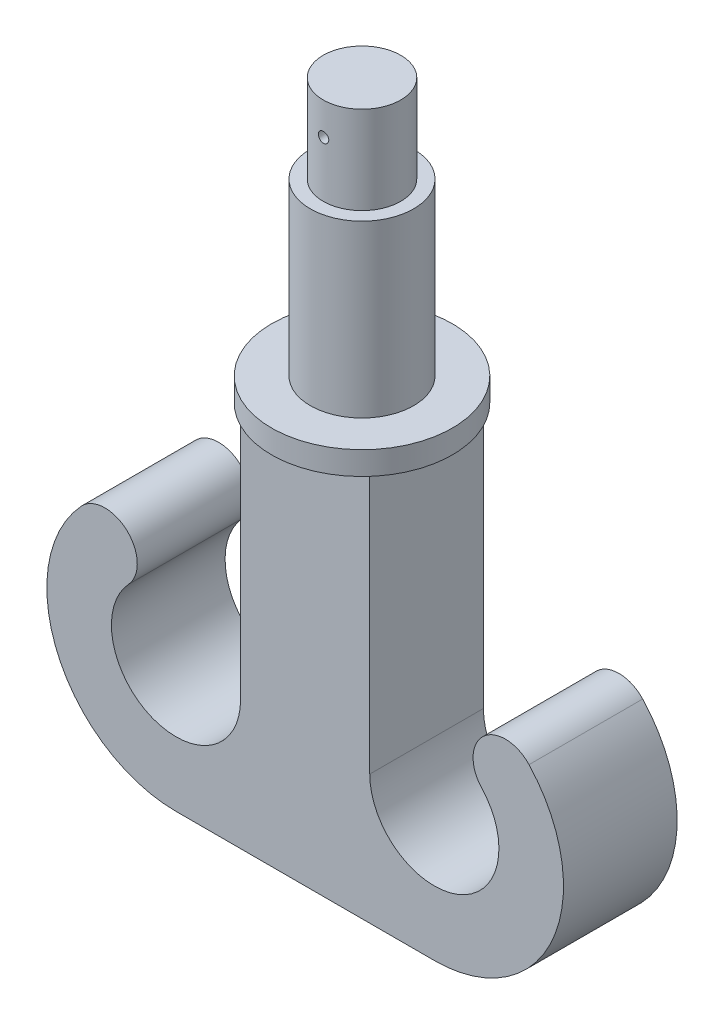
from build123d import *

# Parameters (mm, degrees)
BOSS_EXTRUDE1_DEPTH     = 22
CUT_EXTRUDE1_DEPTH      = 281.757902827
CUT_EXTRUDE1_DEPTH_BACK = 281.757902827
SKETCH3_R               = 2


with BuildPart() as part:
    # Sketch1 → Boss-Extrude1 (new, symmetric)
    with BuildSketch(Plane.XY):
        with BuildLine():
            Line((-50, 0), (50, 0))
            ThreePointArc((50, 0), (95.82575695, 30), (86.66060556, 84))
            ThreePointArc((86.66060556, 84), (68.99545417, 84.66515139), (68.33030278, 67))
            ThreePointArc((68.33030278, 67), (59.130783934, 26.727080442), (25, 50))
            Line((25, 50), (25, 151))
            Line((25, 151), (-25, 151))
            Line((-25, 151), (-25, 50))
            ThreePointArc((-25, 50), (-59.130783934, 26.727080442), (-68.33030278, 67))
            ThreePointArc((-68.33030278, 67), (-68.99545417, 84.66515139), (-86.66060556, 84))
            ThreePointArc((-86.66060556, 84), (-95.82575695, 30), (-50, 0))
        make_face()
    extrude(amount=BOSS_EXTRUDE1_DEPTH, both=True)

    # Sketch2 → Revolve1 (revolve)
    with BuildSketch(Plane.XY, mode=Mode.PRIVATE) as revolve1_sk:
        Polygon((0, 151), (35, 151), (35, 160), (20, 160), (20, 226), (15, 226), (15, 260), (0, 260), align=None)
    revolve(revolve1_sk.sketch.rotate(Axis((0, 260, 0), (0, -1, 0)), 180), axis=Axis((0, 260, 0), (0, -1, 0)))

    # Sketch3 → Cut-Extrude1 (cut, two sides: drawn at the far end of the back side and taken through both)
    with BuildSketch(Plane.XY.offset(-CUT_EXTRUDE1_DEPTH_BACK)):
        with Locations((0, 247.5)):
            Circle(SKETCH3_R)
    extrude(amount=CUT_EXTRUDE1_DEPTH + CUT_EXTRUDE1_DEPTH_BACK, mode=Mode.SUBTRACT)


solid = part.part
